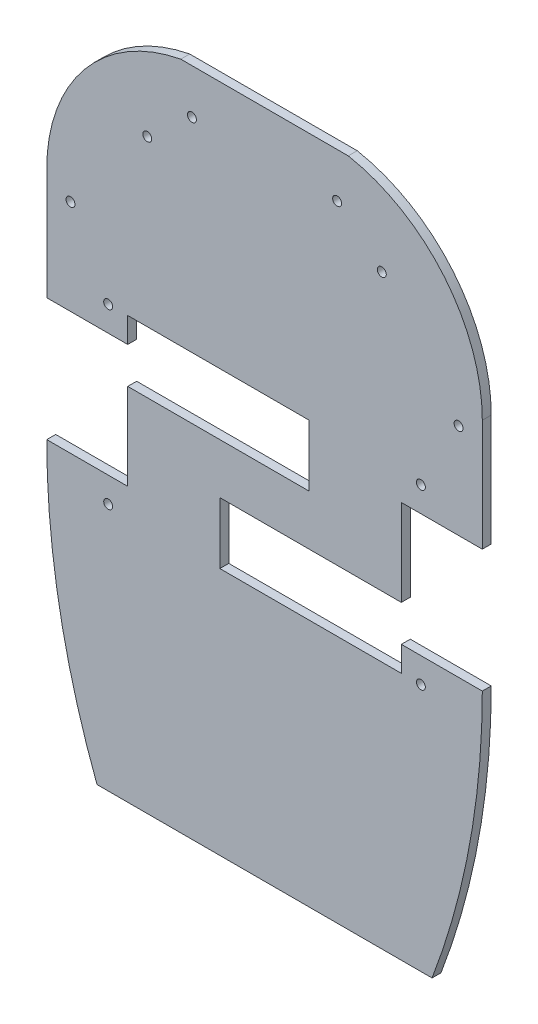
from build123d import *

# Parameters (mm, degrees)
SKETCH_1_R      = 0.8
EXTRUDE_1_DEPTH = 1.6


with BuildPart() as part:
    # 스케치1 → 돌출1 (new body)
    with BuildSketch(Plane.XY):
        with BuildLine():
            Line((39, 0), (9, 0))
            ThreePointArc((9, 0), (2.268662967, 24.090162586), (0, 49))
            Line((0, 49), (14.5, 49))
            Line((14.5, 49), (14.5, 64.5))
            Line((14.5, 64.5), (47, 64.5))
            Line((47, 64.5), (47, 75.5))
            Line((47, 75.5), (14.5, 75.5))
            Line((14.5, 75.5), (14.5, 71))
            Line((14.5, 71), (0, 71))
            Line((0, 71), (0, 91))
            ThreePointArc((0, 91), (6.778150978, 109.821530225), (24, 120))
            Line((24, 120), (39, 120))
            Line((39, 120), (54, 120))
            ThreePointArc((54, 120), (71.221849022, 109.821530225), (78, 91))
            Line((78, 91), (78, 71))
            Line((78, 71), (63.5, 71))
            Line((63.5, 71), (63.5, 55.5))
            Line((63.5, 55.5), (31, 55.5))
            Line((31, 55.5), (31, 44.5))
            Line((31, 44.5), (63.5, 44.5))
            Line((63.5, 44.5), (63.5, 49))
            Line((63.5, 49), (78, 49))
            ThreePointArc((78, 49), (75.731337033, 24.090162586), (69, 0))
            Line((69, 0), (39, 0))
        make_face()
        with Locations((67, 75.5)):
            Circle(SKETCH_1_R, mode=Mode.SUBTRACT)
        with Locations((67, 44.5)):
            Circle(SKETCH_1_R, mode=Mode.SUBTRACT)
        with Locations(Location((11, 44.5, 0), (0, 0, 180))):
            Circle(SKETCH_1_R, mode=Mode.SUBTRACT)
        with Locations(Location((11, 75.5, 0), (0, 0, 180))):
            Circle(SKETCH_1_R, mode=Mode.SUBTRACT)
        with Locations(Location((4.25, 88, 0), (0, 0, 180))):
            Circle(SKETCH_1_R, mode=Mode.SUBTRACT)
        with Locations(Location((73.75, 88, 0), (0, 0, 180))):
            Circle(SKETCH_1_R, mode=Mode.SUBTRACT)
        with Locations(Location((18, 105, 0), (0, 0, 180))):
            Circle(SKETCH_1_R, mode=Mode.SUBTRACT)
        with Locations(Location((60, 105, 0), (0, 0, 180))):
            Circle(SKETCH_1_R, mode=Mode.SUBTRACT)
        with Locations(Location((26, 112, 0), (0, 0, 180))):
            Circle(SKETCH_1_R, mode=Mode.SUBTRACT)
        with Locations(Location((52, 112, 0), (0, 0, 180))):
            Circle(SKETCH_1_R, mode=Mode.SUBTRACT)
    extrude(amount=EXTRUDE_1_DEPTH)


solid = part.part
